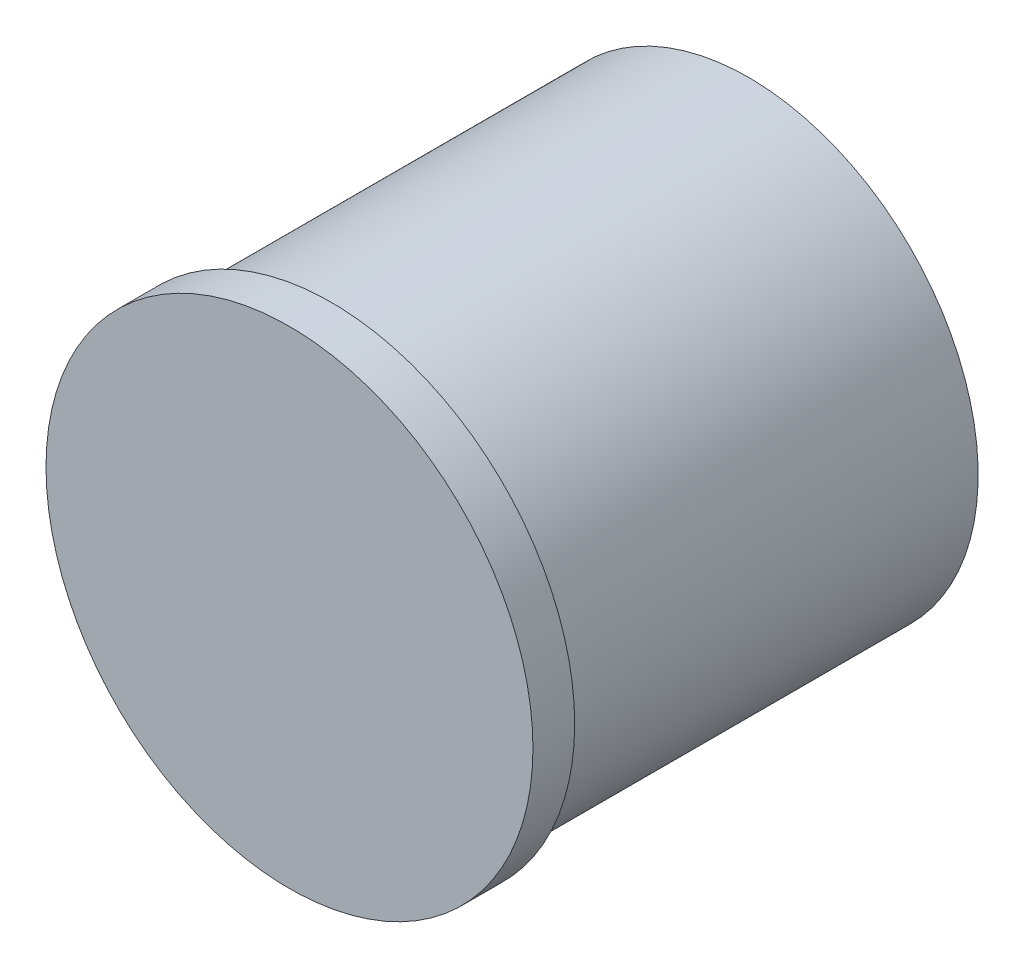
from build123d import *

# Parameters (mm, degrees)
SKETCH1_W           = 3
SKETCH1_H           = 30
SKETCH1_W_2         = 13.5
SKETCH1_H_2         = 3
SKETCH2_R           = 17.5
BOSS_EXTRUDE1_DEPTH = 3


with BuildPart() as part:
    # Sketch1 → Revolve1 (revolve)
    with BuildSketch(Plane(origin=(0, 0, 0), x_dir=(1, 0, 0), z_dir=(0, 1, 0)), mode=Mode.PRIVATE) as revolve1_sk:
        with Locations((15, 0)):
            Rectangle(SKETCH1_W, SKETCH1_H)
        with Locations((6.75, -13.5)):
            Rectangle(SKETCH1_W_2, SKETCH1_H_2)
    revolve(revolve1_sk.sketch.rotate(Axis((0, 0, 0), (0, 0, 1)), 180), axis=Axis((0, 0, 0), (0, 0, 1)))

    # Sketch2 → Boss-Extrude1 (add)
    with BuildSketch(Plane.XY.offset(15)):
        Circle(SKETCH2_R)
    extrude(amount=BOSS_EXTRUDE1_DEPTH)


solid = part.part
